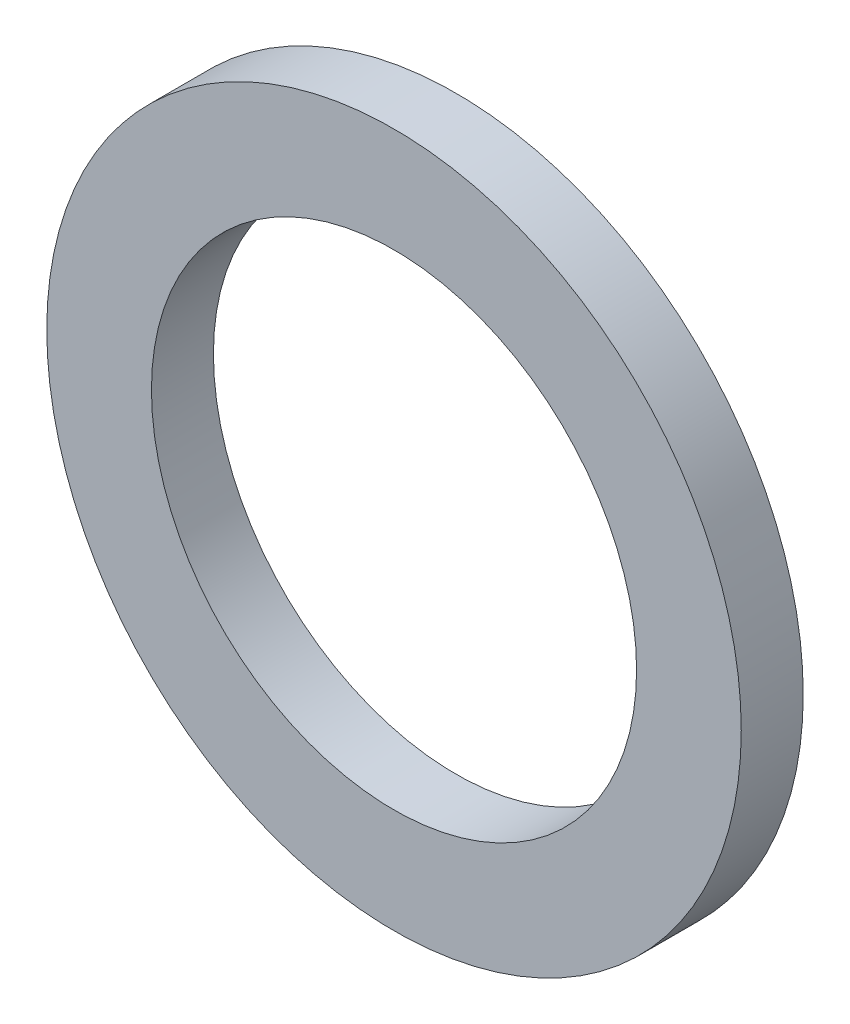
from build123d import *

# Parameters (mm, degrees)
SKETCH1_R           = 26.543
SKETCH1_R_2         = 18.542
BOSS_EXTRUDE1_DEPTH = 4.7371


with BuildPart() as part:
    # Sketch1 → Boss-Extrude1 (new body)
    with BuildSketch(Plane.XY):
        Circle(SKETCH1_R)
        Circle(SKETCH1_R_2, mode=Mode.SUBTRACT)
    extrude(amount=BOSS_EXTRUDE1_DEPTH)


solid = part.part
